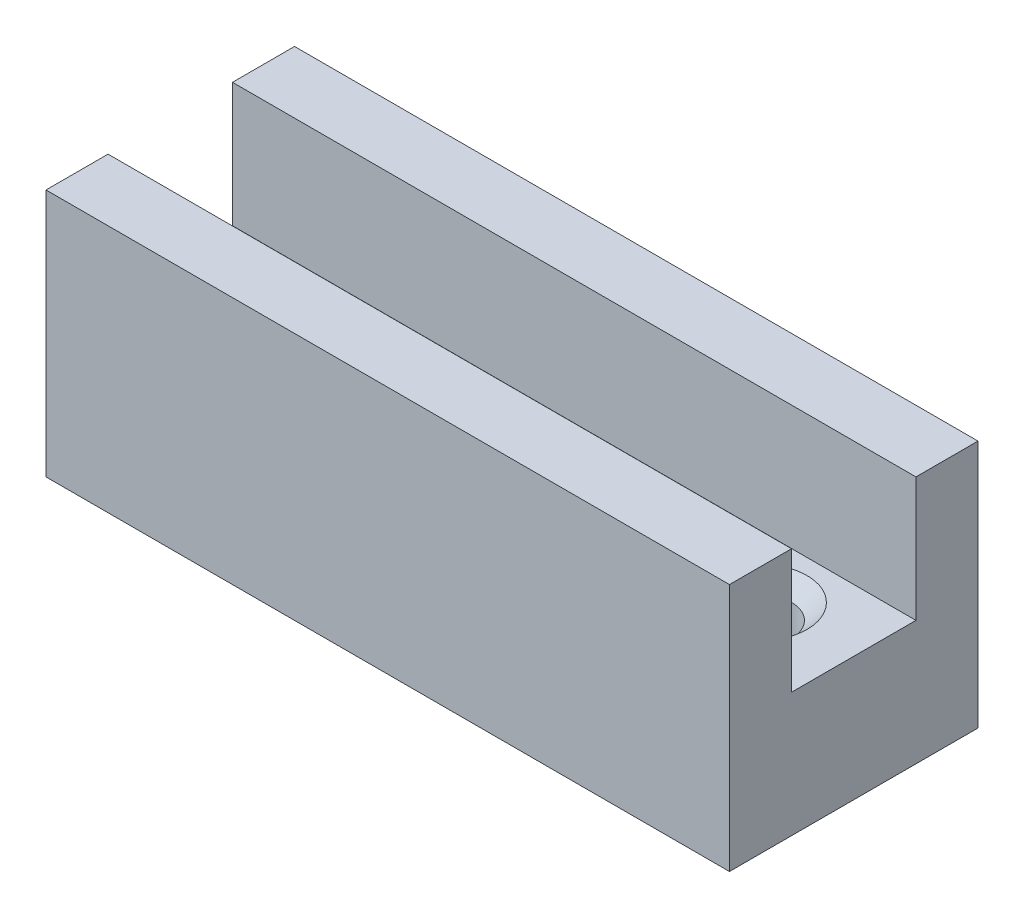
from build123d import *

# Parameters (mm, degrees)
SKETCH1_W           = 279.4
SKETCH1_H           = 101.6
BOSS_EXTRUDE1_DEPTH = 101.6
SKETCH2_W           = 279.4
SKETCH2_H           = 50.868063328
CUT_EXTRUDE1_DEPTH  = 50.8
SKETCH3_R           = 12.7
CUT_EXTRUDE5_DEPTH  = 50.8
SKETCH7_R           = 19.05
CUT_EXTRUDE6_DEPTH  = 19.05
SKETCH8_R           = 12.7
CUT_EXTRUDE7_DEPTH  = 76.2
FILLET3_R           = 6.35
CHAMFER3_SIZE       = 6.35


with BuildPart() as part:
    # Sketch1 → Boss-Extrude1 (new body)
    with BuildSketch(Plane.XY):
        with Locations((139.7, 50.8)):
            Rectangle(SKETCH1_W, SKETCH1_H)
    extrude(amount=BOSS_EXTRUDE1_DEPTH)

    # Sketch2 → Cut-Extrude1 (cut)
    with BuildSketch(Plane(origin=(0, 101.6, 0), x_dir=(1, 0, 0), z_dir=(0, 1, 0))):
        with Locations((139.7, -50.8)):
            Rectangle(SKETCH2_W, SKETCH2_H)
    extrude(amount=-CUT_EXTRUDE1_DEPTH, mode=Mode.SUBTRACT)

    # Sketch3 → Cut-Extrude5 (cut)
    with BuildSketch(Plane(origin=(0, 50.8, 0), x_dir=(1, 0, 0), z_dir=(0, 1, 0))):
        with Locations(Location((38.1, -50.8, 0), (0, 0, 270))):
            Circle(SKETCH3_R)
        with Locations(Location((88.9, -50.8, 0), (0, 0, 270))):
            Circle(SKETCH3_R)
        with Locations(Location((190.5, -50.8, 0), (0, 0, 270))):
            Circle(SKETCH3_R)
        with Locations(Location((241.3, -50.8, 0), (0, 0, 270))):
            Circle(SKETCH3_R)
    extrude(amount=-CUT_EXTRUDE5_DEPTH, mode=Mode.SUBTRACT)

    # Sketch7 → Cut-Extrude6 (cut)
    with BuildSketch(Plane(origin=(0, 50.8, 0), x_dir=(1, 0, 0), z_dir=(0, 1, 0))):
        with Locations(Location((139.7, -50.8, 0), (0, 0, 270))):
            Circle(SKETCH7_R)
    extrude(amount=-CUT_EXTRUDE6_DEPTH, mode=Mode.SUBTRACT)

    # Sketch8 → Cut-Extrude7 (cut)
    with BuildSketch(Plane(origin=(0, 31.75, 0), x_dir=(1, 0, 0), z_dir=(0, 1, 0))):
        with Locations(Location((139.7, -50.8, 0), (0, 0, 270))):
            Circle(SKETCH8_R)
    extrude(amount=-CUT_EXTRUDE7_DEPTH, mode=Mode.SUBTRACT)

    # Fillet3
    fillet3_edges = [part.edges().sort_by_distance(p)[0] for p in [
        (38.1, 50.8, 38.1),
        (88.9, 50.8, 38.1),
    ]]
    fillet(fillet3_edges, radius=FILLET3_R)

    # Chamfer3
    chamfer3_edges = [part.edges().sort_by_distance(p)[0] for p in [
        (190.5, 50.8, 38.1),
        (241.3, 50.8, 38.1),
    ]]
    chamfer(chamfer3_edges, length=CHAMFER3_SIZE)


solid = part.part
